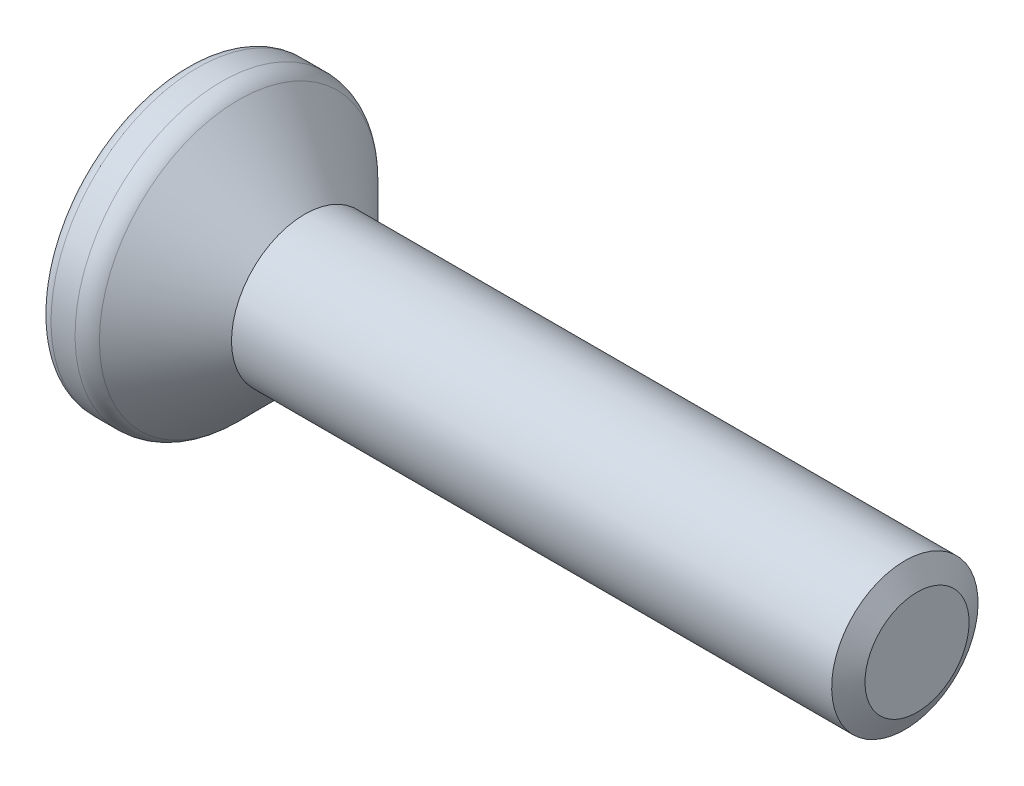
from build123d import *

# Parameters (mm, degrees)
FILLET_1_R          = 0.5
FILLET_2_R          = 1
CUT_EXTRUDE_1_DEPTH = 2.5
CHAMFER_1_SIZE      = 0.5
CHAMFER_1_SIZE2     = 0.866025404


with BuildPart() as part:
    # 草图1 → 旋转1 (revolve)
    with BuildSketch(Plane.XY):
        Polygon((15, 0), (-15, 0), (-15, 6), (-13.1, 6), (-10.1, 3), (15, 3), align=None)
    revolve(axis=Axis((15, 0, 0), (-1, 0, 0)))

    # 圆角1
    fillet_1_edges = [part.edges().sort_by_distance(p)[0] for p in [
        (-15, -6, 0),
    ]]
    fillet(fillet_1_edges, radius=FILLET_1_R)

    # 圆角2
    fillet_2_edges = [part.edges().sort_by_distance(p)[0] for p in [
        (-13.1, -6, 0),
    ]]
    fillet(fillet_2_edges, radius=FILLET_2_R)

    # 草图2 → 切除-拉伸1 (cut)
    with BuildSketch(Plane.ZY.offset(15)):
        Polygon((0, 2.309401077), (-2, 1.154700538), (-2, -1.154700538), (0, -2.309401077), (2, -1.154700538), (2, 1.154700538), align=None)
    extrude(amount=-CUT_EXTRUDE_1_DEPTH, mode=Mode.SUBTRACT)

    # 倒角1
    chamfer_1_edges = [part.edges().sort_by_distance(p)[0] for p in [
        (15, -3, 0),
    ]]
    chamfer_1_side = [part.faces().sort_by_distance(p)[0] for p in [
        (2.45, -3, 0),
    ]]
    chamfer(chamfer_1_edges, length=CHAMFER_1_SIZE, length2=CHAMFER_1_SIZE2, reference=chamfer_1_side[0])


solid = part.part
